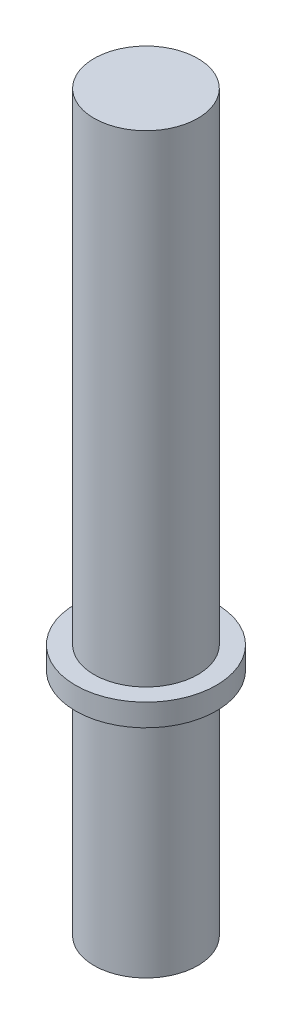
from build123d import *

# Parameters (mm, degrees)
BOSS_EXTRUDE1_DEPTH      = 65
BOSS_EXTRUDE1_DEPTH_BACK = 34
SKETCH1_R                = 7
SKETCH2_R                = 9.5
BOSS_EXTRUDE2_DEPTH      = 3


with BuildPart() as part:
    # Sketch1 → Boss-Extrude1 (new, two sides: drawn at the far end of the back side and taken through both)
    with BuildSketch(Plane(origin=(0, 0, 0), x_dir=(1, 0, 0), z_dir=(0, 1, 0)).offset(-BOSS_EXTRUDE1_DEPTH_BACK)):
        with Locations(Location((0, 0, 0), (0, 0, 270))):
            Circle(SKETCH1_R)
    extrude(amount=BOSS_EXTRUDE1_DEPTH + BOSS_EXTRUDE1_DEPTH_BACK)

    # Sketch2 → Boss-Extrude2 (add)
    with BuildSketch(Plane(origin=(0, 0, 0), x_dir=(1, 0, 0), z_dir=(0, 1, 0))):
        with Locations(Location((0, 0, 0), (0, 0, 270))):
            Circle(SKETCH2_R)
    extrude(amount=-BOSS_EXTRUDE2_DEPTH)


solid = part.part
